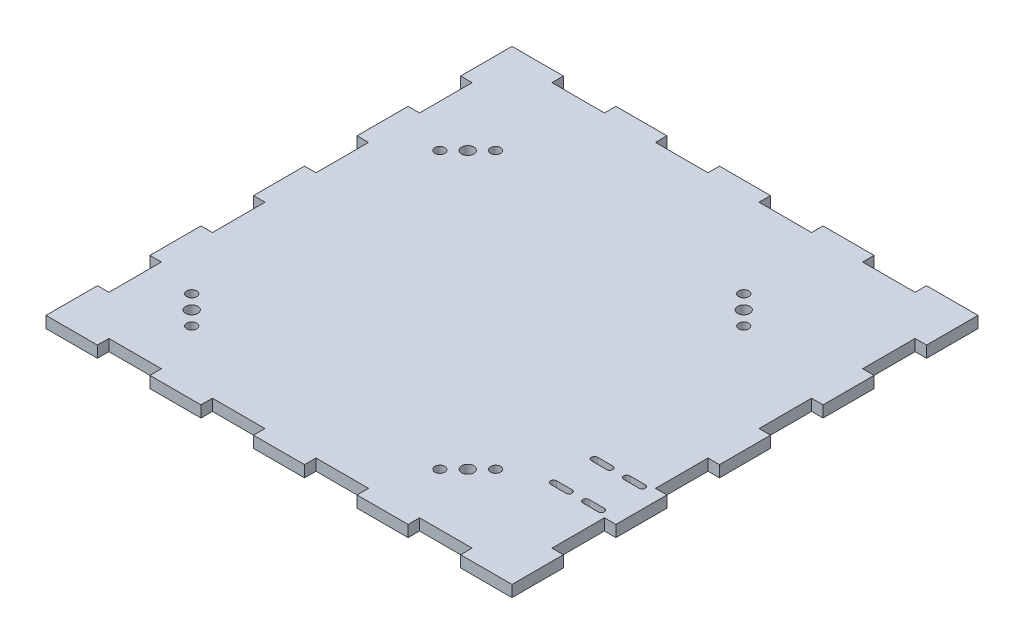
from build123d import *

# Parameters (mm, degrees)
SKETCH2_W           = 130
SKETCH2_H           = 130
SKETCH2_R           = 1.7
BOSS_EXTRUDE1_DEPTH = 3.2
CUT_EXTRUDE2_REACH  = 102.725
SKETCH5_R           = 1.4
SKETCH4_W           = 3.2
SKETCH4_H           = 14.444444445
SKETCH4_W_2         = 14.444444445
SKETCH4_H_2         = 3.2
CUT_EXTRUDE1_DEPTH  = 101.724934847
CUT_EXTRUDE3_REACH  = 102.725
TOLERANCE_BY        = 0.1
TOLERANCE_2_BY      = 0.1
TOLERANCE_3_BY      = 0.1
TOLERANCE_4_BY      = 0.1
TOLERANCE_5_BY      = 0.1
TOLERANCE_6_BY      = 0.1
TOLERANCE_7_BY      = 0.1
TOLERANCE_8_BY      = 0.1
TOLERANCE_9_BY      = 0.1
TOLERANCE_10_BY     = 0.1
TOLERANCE_11_BY     = 0.1
TOLERANCE_12_BY     = 0.1
TOLERANCE_13_BY     = 0.1
TOLERANCE_14_BY     = 0.1
TOLERANCE_15_BY     = 0.1
TOLERANCE_16_BY     = 0.1
TOLERANCE_17_BY     = 0.1
TOLERANCE_18_BY     = 0.1
TOLERANCE_19_BY     = 0.1
TOLERANCE_20_BY     = 0.1
TOLERANCE_21_BY     = 0.1
TOLERANCE_22_BY     = 0.1
TOLERANCE_23_BY     = 0.1
TOLERANCE_24_BY     = 0.1
TOLERANCE_25_BY     = 0.1
TOLERANCE_26_BY     = 0.1
TOLERANCE_27_BY     = 0.1
TOLERANCE_28_BY     = 0.1
TOLERANCE_29_BY     = 0.1
TOLERANCE_30_BY     = 0.1
TOLERANCE_31_BY     = 0.1
TOLERANCE_32_BY     = 0.1


with BuildPart() as part:
    # Sketch2 → Boss-Extrude1 (new body)
    with BuildSketch(Plane(origin=(0, 0, 0), x_dir=(1, 0, 0), z_dir=(0, 1, 0))):
        with Locations((7.5, 4.85)):
            Rectangle(SKETCH2_W, SKETCH2_H)
        with Locations(Location((-38.5, 38.5, 0), (0, 0, 270))):
            Circle(SKETCH2_R, mode=Mode.SUBTRACT)
        with Locations(Location((-38.5, -38.5, 0), (0, 0, 270))):
            Circle(SKETCH2_R, mode=Mode.SUBTRACT)
        with Locations(Location((38.5, -38.5, 0), (0, 0, 270))):
            Circle(SKETCH2_R, mode=Mode.SUBTRACT)
        with Locations(Location((38.5, 38.5, 0), (0, 0, 270))):
            Circle(SKETCH2_R, mode=Mode.SUBTRACT)
    extrude(amount=BOSS_EXTRUDE1_DEPTH)

    # Sketch5 → Cut-Extrude2 (cut, up to next)
    with BuildSketch(Plane(origin=(0, 3.2, 0), x_dir=(1, 0, 0), z_dir=(0, 1, 0)), mode=Mode.PRIVATE) as cut_extrude2_sk1:
        with Locations(Location((42.389087297, 34.610912703, 0), (0, 0, 270))):
            Circle(SKETCH5_R)
    cut_extrude2_tool1 = extrude(cut_extrude2_sk1.sketch, amount=-CUT_EXTRUDE2_REACH, mode=Mode.PRIVATE) & part.part
    # Sketch5 → Cut-Extrude2 (cut, up to next)
    with BuildSketch(Plane(origin=(0, 3.2, 0), x_dir=(1, 0, 0), z_dir=(0, 1, 0)), mode=Mode.PRIVATE) as cut_extrude2_sk2:
        with Locations(Location((34.610912703, 42.389087297, 0), (0, 0, 270))):
            Circle(SKETCH5_R)
    cut_extrude2_tool2 = extrude(cut_extrude2_sk2.sketch, amount=-CUT_EXTRUDE2_REACH, mode=Mode.PRIVATE) & part.part
    # Sketch5 → Cut-Extrude2 (cut, up to next)
    with BuildSketch(Plane(origin=(0, 3.2, 0), x_dir=(1, 0, 0), z_dir=(0, 1, 0)), mode=Mode.PRIVATE) as cut_extrude2_sk3:
        with Locations(Location((34.610912703, -42.389087297, 0), (0, 0, 270))):
            Circle(SKETCH5_R)
    cut_extrude2_tool3 = extrude(cut_extrude2_sk3.sketch, amount=-CUT_EXTRUDE2_REACH, mode=Mode.PRIVATE) & part.part
    # Sketch5 → Cut-Extrude2 (cut, up to next)
    with BuildSketch(Plane(origin=(0, 3.2, 0), x_dir=(1, 0, 0), z_dir=(0, 1, 0)), mode=Mode.PRIVATE) as cut_extrude2_sk4:
        with Locations(Location((42.389087297, -34.610912703, 0), (0, 0, 270))):
            Circle(SKETCH5_R)
    cut_extrude2_tool4 = extrude(cut_extrude2_sk4.sketch, amount=-CUT_EXTRUDE2_REACH, mode=Mode.PRIVATE) & part.part
    # Sketch5 → Cut-Extrude2 (cut, up to next)
    with BuildSketch(Plane(origin=(0, 3.2, 0), x_dir=(1, 0, 0), z_dir=(0, 1, 0)), mode=Mode.PRIVATE) as cut_extrude2_sk5:
        with Locations(Location((-42.389087297, -34.610912703, 0), (0, 0, 270))):
            Circle(SKETCH5_R)
    cut_extrude2_tool5 = extrude(cut_extrude2_sk5.sketch, amount=-CUT_EXTRUDE2_REACH, mode=Mode.PRIVATE) & part.part
    # Sketch5 → Cut-Extrude2 (cut, up to next)
    with BuildSketch(Plane(origin=(0, 3.2, 0), x_dir=(1, 0, 0), z_dir=(0, 1, 0)), mode=Mode.PRIVATE) as cut_extrude2_sk6:
        with Locations(Location((-34.610912703, -42.389087297, 0), (0, 0, 270))):
            Circle(SKETCH5_R)
    cut_extrude2_tool6 = extrude(cut_extrude2_sk6.sketch, amount=-CUT_EXTRUDE2_REACH, mode=Mode.PRIVATE) & part.part
    # Sketch5 → Cut-Extrude2 (cut, up to next)
    with BuildSketch(Plane(origin=(0, 3.2, 0), x_dir=(1, 0, 0), z_dir=(0, 1, 0)), mode=Mode.PRIVATE) as cut_extrude2_sk7:
        with Locations(Location((-34.610912703, 42.389087297, 0), (0, 0, 270))):
            Circle(SKETCH5_R)
    cut_extrude2_tool7 = extrude(cut_extrude2_sk7.sketch, amount=-CUT_EXTRUDE2_REACH, mode=Mode.PRIVATE) & part.part
    # Sketch5 → Cut-Extrude2 (cut, up to next)
    with BuildSketch(Plane(origin=(0, 3.2, 0), x_dir=(1, 0, 0), z_dir=(0, 1, 0)), mode=Mode.PRIVATE) as cut_extrude2_sk8:
        with Locations(Location((-42.389087297, 34.610912703, 0), (0, 0, 270))):
            Circle(SKETCH5_R)
    cut_extrude2_tool8 = extrude(cut_extrude2_sk8.sketch, amount=-CUT_EXTRUDE2_REACH, mode=Mode.PRIVATE) & part.part
    add(cut_extrude2_tool1.solids().sort_by_distance((42.389087, 3.2, -34.610913))[0], mode=Mode.SUBTRACT)
    add(cut_extrude2_tool2.solids().sort_by_distance((34.610913, 3.2, -42.389087))[0], mode=Mode.SUBTRACT)
    add(cut_extrude2_tool3.solids().sort_by_distance((34.610913, 3.2, 42.389087))[0], mode=Mode.SUBTRACT)
    add(cut_extrude2_tool4.solids().sort_by_distance((42.389087, 3.2, 34.610913))[0], mode=Mode.SUBTRACT)
    add(cut_extrude2_tool5.solids().sort_by_distance((-42.389087, 3.2, 34.610913))[0], mode=Mode.SUBTRACT)
    add(cut_extrude2_tool6.solids().sort_by_distance((-34.610913, 3.2, 42.389087))[0], mode=Mode.SUBTRACT)
    add(cut_extrude2_tool7.solids().sort_by_distance((-34.610913, 3.2, -42.389087))[0], mode=Mode.SUBTRACT)
    add(cut_extrude2_tool8.solids().sort_by_distance((-42.389087, 3.2, -34.610913))[0], mode=Mode.SUBTRACT)

    # Sketch4 → Cut-Extrude1 (cut, through all)
    with BuildSketch(Plane(origin=(0, 3.2, 0), x_dir=(1, 0, 0), z_dir=(0, 1, 0))):
        with Locations((70.9, 48.183333334)):
            Rectangle(SKETCH4_W, SKETCH4_H)
        with Locations((70.9, 19.294444445)):
            Rectangle(SKETCH4_W, SKETCH4_H)
        with Locations((70.9, -9.594444445)):
            Rectangle(SKETCH4_W, SKETCH4_H)
        with Locations((70.9, -38.483333333)):
            Rectangle(SKETCH4_W, SKETCH4_H)
        with Locations((-35.833333334, -58.55)):
            Rectangle(SKETCH4_W_2, SKETCH4_H_2)
        with Locations((-6.944444445, -58.55)):
            Rectangle(SKETCH4_W_2, SKETCH4_H_2)
        with Locations((21.944444445, -58.55)):
            Rectangle(SKETCH4_W_2, SKETCH4_H_2)
        with Locations((50.833333334, -58.55)):
            Rectangle(SKETCH4_W_2, SKETCH4_H_2)
        with Locations((-55.9, 48.183333334)):
            Rectangle(SKETCH4_W, SKETCH4_H)
        with Locations((-55.9, 19.294444445)):
            Rectangle(SKETCH4_W, SKETCH4_H)
        with Locations((-55.9, -9.594444445)):
            Rectangle(SKETCH4_W, SKETCH4_H)
        with Locations((-55.9, -38.483333333)):
            Rectangle(SKETCH4_W, SKETCH4_H)
        with Locations((50.833333334, 68.25)):
            Rectangle(SKETCH4_W_2, SKETCH4_H_2)
        with Locations((21.944444445, 68.25)):
            Rectangle(SKETCH4_W_2, SKETCH4_H_2)
        with Locations((-6.944444445, 68.25)):
            Rectangle(SKETCH4_W_2, SKETCH4_H_2)
        with Locations((-35.833333334, 68.25)):
            Rectangle(SKETCH4_W_2, SKETCH4_H_2)
    extrude(amount=-CUT_EXTRUDE1_DEPTH, mode=Mode.SUBTRACT)

    # Sketch6 → Cut-Extrude3 (cut, up to next)
    with BuildSketch(Plane(origin=(0, 3.2, 0), x_dir=(1, 0, 0), z_dir=(0, 1, 0)), mode=Mode.PRIVATE) as cut_extrude3_sk1:
        with BuildLine():
            Line((67, -30.588888889), (62.7, -30.588888889))
            ThreePointArc((62.7, -30.588888889), (61.85, -29.738888889), (62.7, -28.888888889))
            Line((62.7, -28.888888889), (67, -28.888888889))
            ThreePointArc((67, -28.888888889), (67.85, -29.738888889), (67, -30.588888889))
        make_face()
    cut_extrude3_tool1 = extrude(cut_extrude3_sk1.sketch, amount=-CUT_EXTRUDE3_REACH, mode=Mode.PRIVATE) & part.part
    # Sketch6 → Cut-Extrude3 (cut, up to next)
    with BuildSketch(Plane(origin=(0, 3.2, 0), x_dir=(1, 0, 0), z_dir=(0, 1, 0)), mode=Mode.PRIVATE) as cut_extrude3_sk2:
        with BuildLine():
            Line((58, -30.588888889), (53.7, -30.588888889))
            ThreePointArc((53.7, -30.588888889), (52.85, -29.738888889), (53.7, -28.888888889))
            Line((53.7, -28.888888889), (58, -28.888888889))
            ThreePointArc((58, -28.888888889), (58.85, -29.738888889), (58, -30.588888889))
        make_face()
    cut_extrude3_tool2 = extrude(cut_extrude3_sk2.sketch, amount=-CUT_EXTRUDE3_REACH, mode=Mode.PRIVATE) & part.part
    # Sketch6 → Cut-Extrude3 (cut, up to next)
    with BuildSketch(Plane(origin=(0, 3.2, 0), x_dir=(1, 0, 0), z_dir=(0, 1, 0)), mode=Mode.PRIVATE) as cut_extrude3_sk3:
        with BuildLine():
            Line((58, -17.488888889), (53.7, -17.488888889))
            ThreePointArc((53.7, -17.488888889), (52.85, -18.338888889), (53.7, -19.188888889))
            Line((53.7, -19.188888889), (58, -19.188888889))
            ThreePointArc((58, -19.188888889), (58.85, -18.338888889), (58, -17.488888889))
        make_face()
    cut_extrude3_tool3 = extrude(cut_extrude3_sk3.sketch, amount=-CUT_EXTRUDE3_REACH, mode=Mode.PRIVATE) & part.part
    # Sketch6 → Cut-Extrude3 (cut, up to next)
    with BuildSketch(Plane(origin=(0, 3.2, 0), x_dir=(1, 0, 0), z_dir=(0, 1, 0)), mode=Mode.PRIVATE) as cut_extrude3_sk4:
        with BuildLine():
            Line((67, -17.488888889), (62.7, -17.488888889))
            ThreePointArc((62.7, -17.488888889), (61.85, -18.338888889), (62.7, -19.188888889))
            Line((62.7, -19.188888889), (67, -19.188888889))
            ThreePointArc((67, -19.188888889), (67.85, -18.338888889), (67, -17.488888889))
        make_face()
    cut_extrude3_tool4 = extrude(cut_extrude3_sk4.sketch, amount=-CUT_EXTRUDE3_REACH, mode=Mode.PRIVATE) & part.part
    add(cut_extrude3_tool1.solids().sort_by_distance((64.85, 3.2, 29.738889))[0], mode=Mode.SUBTRACT)
    add(cut_extrude3_tool2.solids().sort_by_distance((55.85, 3.2, 29.738889))[0], mode=Mode.SUBTRACT)
    add(cut_extrude3_tool3.solids().sort_by_distance((55.85, 3.2, 18.338889))[0], mode=Mode.SUBTRACT)
    add(cut_extrude3_tool4.solids().sort_by_distance((64.85, 3.2, 18.338889))[0], mode=Mode.SUBTRACT)

    # Tolerance: a face moved inward by 0.1
    extrude(part.faces().sort_by_distance((43.611111111, 1.6, -68.25))[0], amount=TOLERANCE_BY, dir=(-1, 0, 0), mode=Mode.SUBTRACT)

    # Tolerance 2: a face moved inward by 0.1
    extrude(part.faces().sort_by_distance((14.722222222, 1.6, -68.25))[0], amount=TOLERANCE_2_BY, dir=(-1, 0, 0), mode=Mode.SUBTRACT)

    # Tolerance 3: a face moved inward by 0.1
    extrude(part.faces().sort_by_distance((-14.166666667, 1.6, -68.25))[0], amount=TOLERANCE_3_BY, dir=(-1, 0, 0), mode=Mode.SUBTRACT)

    # Tolerance 4: a face moved inward by 0.1
    extrude(part.faces().sort_by_distance((-43.055555556, 1.6, -68.25))[0], amount=TOLERANCE_4_BY, dir=(-1, 0, 0), mode=Mode.SUBTRACT)

    # Tolerance 5: a face moved inward by 0.1
    extrude(part.faces().sort_by_distance((29.166666667, 1.6, -68.25))[0], amount=TOLERANCE_5_BY, dir=(1, 0, 0), mode=Mode.SUBTRACT)

    # Tolerance 6: a face moved inward by 0.1
    extrude(part.faces().sort_by_distance((58.055555556, 1.6, -68.25))[0], amount=TOLERANCE_6_BY, dir=(1, 0, 0), mode=Mode.SUBTRACT)

    # Tolerance 7: a face moved inward by 0.1
    extrude(part.faces().sort_by_distance((0.277777778, 1.6, -68.25))[0], amount=TOLERANCE_7_BY, dir=(1, 0, 0), mode=Mode.SUBTRACT)

    # Tolerance 8: a face moved inward by 0.1
    extrude(part.faces().sort_by_distance((-28.611111111, 1.6, -68.25))[0], amount=TOLERANCE_8_BY, dir=(1, 0, 0), mode=Mode.SUBTRACT)

    # Tolerance 9: a face moved inward by 0.1
    extrude(part.faces().sort_by_distance((-55.9, 1.6, -40.961111111))[0], amount=TOLERANCE_9_BY, dir=(0, 0, 1), mode=Mode.SUBTRACT)

    # Tolerance 10: a face moved inward by 0.1
    extrude(part.faces().sort_by_distance((-55.9, 1.6, -55.405555556))[0], amount=TOLERANCE_10_BY, dir=(0, 0, -1), mode=Mode.SUBTRACT)

    # Tolerance 11: a face moved inward by 0.1
    extrude(part.faces().sort_by_distance((-55.9, 1.6, -12.072222222))[0], amount=TOLERANCE_11_BY, dir=(0, 0, 1), mode=Mode.SUBTRACT)

    # Tolerance 12: a face moved inward by 0.1
    extrude(part.faces().sort_by_distance((-55.9, 1.6, -26.516666667))[0], amount=TOLERANCE_12_BY, dir=(0, 0, -1), mode=Mode.SUBTRACT)

    # Tolerance 13: a face moved inward by 0.1
    extrude(part.faces().sort_by_distance((-55.9, 1.6, 2.372222222))[0], amount=TOLERANCE_13_BY, dir=(0, 0, -1), mode=Mode.SUBTRACT)

    # Tolerance 14: a face moved inward by 0.1
    extrude(part.faces().sort_by_distance((-55.9, 1.6, 16.816666667))[0], amount=TOLERANCE_14_BY, dir=(0, 0, 1), mode=Mode.SUBTRACT)

    # Tolerance 15: a face moved inward by 0.1
    extrude(part.faces().sort_by_distance((-55.9, 1.6, 45.705555556))[0], amount=TOLERANCE_15_BY, dir=(0, 0, 1), mode=Mode.SUBTRACT)

    # Tolerance 16: a face moved inward by 0.1
    extrude(part.faces().sort_by_distance((-55.9, 1.6, 31.261111111))[0], amount=TOLERANCE_16_BY, dir=(0, 0, -1), mode=Mode.SUBTRACT)

    # Tolerance 17: a face moved inward by 0.1
    extrude(part.faces().sort_by_distance((-28.611111111, 1.6, 58.55))[0], amount=TOLERANCE_17_BY, dir=(1, 0, 0), mode=Mode.SUBTRACT)

    # Tolerance 18: a face moved inward by 0.1
    extrude(part.faces().sort_by_distance((-43.055555556, 1.6, 58.55))[0], amount=TOLERANCE_18_BY, dir=(-1, 0, 0), mode=Mode.SUBTRACT)

    # Tolerance 19: a face moved inward by 0.1
    extrude(part.faces().sort_by_distance((-14.166666667, 1.6, 58.55))[0], amount=TOLERANCE_19_BY, dir=(-1, 0, 0), mode=Mode.SUBTRACT)

    # Tolerance 20: a face moved inward by 0.1
    extrude(part.faces().sort_by_distance((0.277777778, 1.6, 58.55))[0], amount=TOLERANCE_20_BY, dir=(1, 0, 0), mode=Mode.SUBTRACT)

    # Tolerance 21: a face moved inward by 0.1
    extrude(part.faces().sort_by_distance((14.722222222, 1.6, 58.55))[0], amount=TOLERANCE_21_BY, dir=(-1, 0, 0), mode=Mode.SUBTRACT)

    # Tolerance 22: a face moved inward by 0.1
    extrude(part.faces().sort_by_distance((29.166666667, 1.6, 58.55))[0], amount=TOLERANCE_22_BY, dir=(1, 0, 0), mode=Mode.SUBTRACT)

    # Tolerance 23: a face moved inward by 0.1
    extrude(part.faces().sort_by_distance((58.055555556, 1.6, 58.55))[0], amount=TOLERANCE_23_BY, dir=(1, 0, 0), mode=Mode.SUBTRACT)

    # Tolerance 24: a face moved inward by 0.1
    extrude(part.faces().sort_by_distance((43.611111111, 1.6, 58.55))[0], amount=TOLERANCE_24_BY, dir=(-1, 0, 0), mode=Mode.SUBTRACT)

    # Tolerance 25: a face moved inward by 0.1
    extrude(part.faces().sort_by_distance((70.9, 1.6, 31.261111111))[0], amount=TOLERANCE_25_BY, dir=(0, 0, -1), mode=Mode.SUBTRACT)

    # Tolerance 26: a face moved inward by 0.1
    extrude(part.faces().sort_by_distance((70.9, 1.6, 45.705555556))[0], amount=TOLERANCE_26_BY, dir=(0, 0, 1), mode=Mode.SUBTRACT)

    # Tolerance 27: a face moved inward by 0.1
    extrude(part.faces().sort_by_distance((70.9, 1.6, 16.816666667))[0], amount=TOLERANCE_27_BY, dir=(0, 0, 1), mode=Mode.SUBTRACT)

    # Tolerance 28: a face moved inward by 0.1
    extrude(part.faces().sort_by_distance((70.9, 1.6, 2.372222222))[0], amount=TOLERANCE_28_BY, dir=(0, 0, -1), mode=Mode.SUBTRACT)

    # Tolerance 29: a face moved inward by 0.1
    extrude(part.faces().sort_by_distance((70.9, 1.6, -12.072222222))[0], amount=TOLERANCE_29_BY, dir=(0, 0, 1), mode=Mode.SUBTRACT)

    # Tolerance 30: a face moved inward by 0.1
    extrude(part.faces().sort_by_distance((70.9, 1.6, -26.516666667))[0], amount=TOLERANCE_30_BY, dir=(0, 0, -1), mode=Mode.SUBTRACT)

    # Tolerance 31: a face moved inward by 0.1
    extrude(part.faces().sort_by_distance((70.9, 1.6, -55.405555556))[0], amount=TOLERANCE_31_BY, dir=(0, 0, -1), mode=Mode.SUBTRACT)

    # Tolerance 32: a face moved inward by 0.1
    extrude(part.faces().sort_by_distance((70.9, 1.6, -40.961111111))[0], amount=TOLERANCE_32_BY, dir=(0, 0, 1), mode=Mode.SUBTRACT)


solid = part.part
